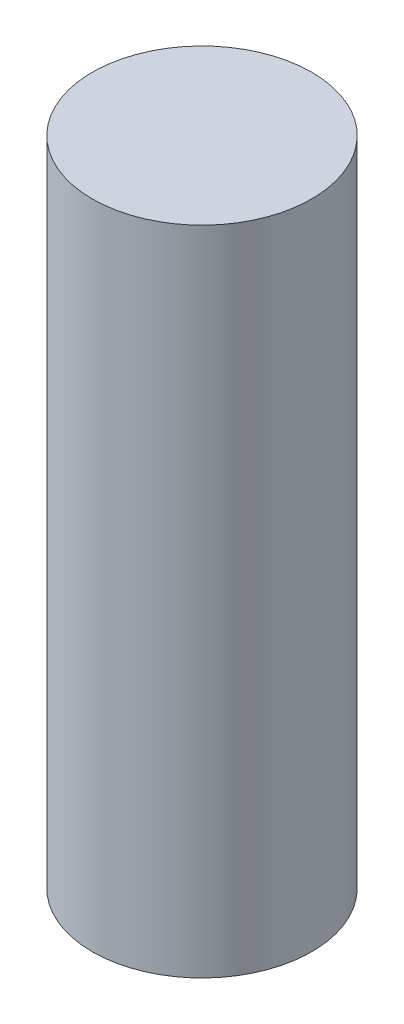
from build123d import *

# Parameters (mm, degrees)
CROQUIS1_R              = 2.525
SALIENTE_EXTRUIR1_DEPTH = 7.5


with BuildPart() as part:
    # Croquis1 → Saliente-Extruir1 (new, symmetric)
    with BuildSketch(Plane(origin=(0, 0, 0), x_dir=(1, 0, 0), z_dir=(0, 1, 0))):
        with Locations(Location((0, 0, 0), (0, 0, 270))):
            Circle(CROQUIS1_R)
    extrude(amount=SALIENTE_EXTRUIR1_DEPTH, both=True)


solid = part.part
